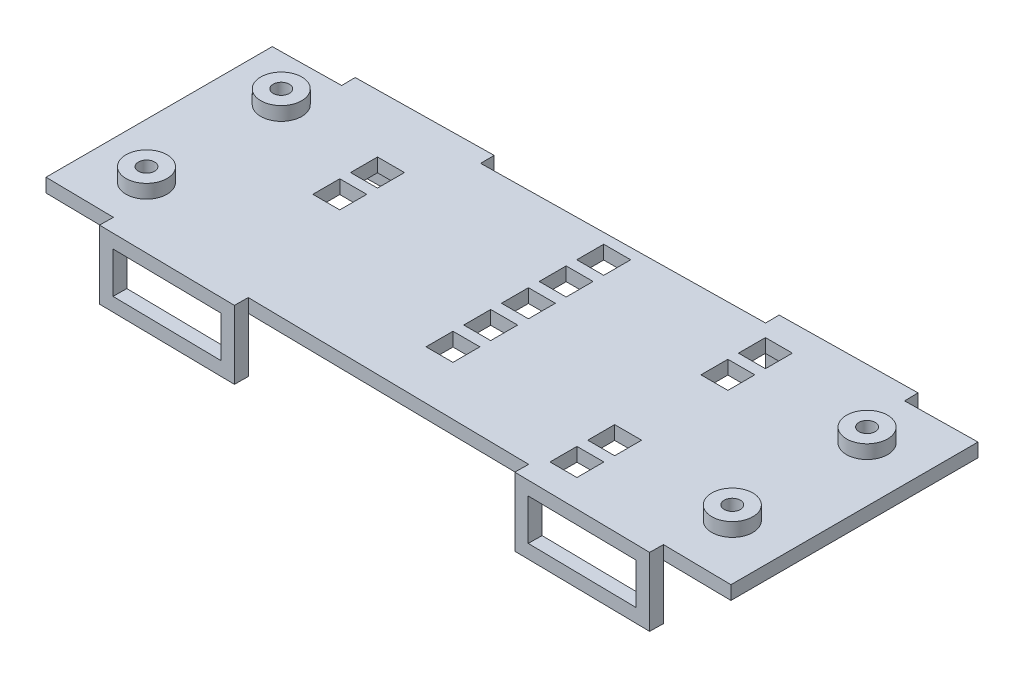
from build123d import *

# Parameters (mm, degrees)
BOSS_EXTRUDE1_DEPTH = 2.54
SKETCH3_W           = 25.4
SKETCH3_H           = 12.7
SKETCH3_W_2         = 20.32
SKETCH3_H_2         = 7.62
BOSS_EXTRUDE3_DEPTH = 2.54
SKETCH4_R           = 1.905
BOSS_EXTRUDE4_DEPTH = 5.08
SKETCH5_R           = 3.81
SKETCH5_R_2         = 1.5
BOSS_EXTRUDE5_DEPTH = 2.54
SKETCH6_W           = 25.4
SKETCH6_H           = 12.7
SKETCH6_W_2         = 20.32
SKETCH6_H_2         = 7.62
BOSS_EXTRUDE8_DEPTH = 2.54
SKETCH12_W          = 5
SKETCH12_H          = 5
CUT_EXTRUDE1_DEPTH  = 2.54


with BuildPart() as part:
    # Sketch2 → Boss-Extrude1 (new body)
    with BuildSketch(Plane(origin=(0, 0, 0), x_dir=(1, 0, 0), z_dir=(0, 1, 0))):
        Polygon((-80.183865598, 25.601069918), (48.816134402, 27.536069918), (48.816134402, -18.304155069), (-80.183865598, -16.369155069), align=None)
    extrude(amount=BOSS_EXTRUDE1_DEPTH)

    # Sketch3 → Boss-Extrude3 (add)
    # profile 1 of 2: a face of its own
    with BuildSketch(Plane(origin=(0.046703878, 0, 17.572613611), x_dir=(0.9998875189808162, 0, 0.014998312784712321), z_dir=(-0.01499831278471232, 0, 0.9998875189808161))):
        with Locations((-54.839594907, -3.81)):
            Rectangle(SKETCH3_W, SKETCH3_H)
        with Locations((-54.839594907, -3.81)):
            Rectangle(SKETCH3_W_2, SKETCH3_H_2, mode=Mode.SUBTRACT)
    # profile 2 of 2: a face of its own
    with BuildSketch(Plane(origin=(0.046703878, 0, 17.572613611), x_dir=(0.9998875189808162, 0, 0.014998312784712321), z_dir=(-0.01499831278471232, 0, 0.9998875189808161))):
        with Locations((23.374916777, -3.81)):
            Rectangle(SKETCH3_W, SKETCH3_H)
        with Locations((23.374916777, -3.81)):
            Rectangle(SKETCH3_W_2, SKETCH3_H_2, mode=Mode.SUBTRACT)
    extrude(amount=BOSS_EXTRUDE3_DEPTH)

    # Sketch4 → Boss-Extrude4 (add)
    with BuildSketch(Plane.XZ):
        with Locations(Location((-72.563865598, 8.982611367, 0), (0, 0, 270))):
            Circle(SKETCH4_R)
        with Locations(Location((-72.183865598, -18.220226216, 0), (0, 0, 270))):
            Circle(SKETCH4_R)
        with Locations(Location((41.196134402, -19.920926216, 0), (0, 0, 270))):
            Circle(SKETCH4_R)
        with Locations(Location((41.196134402, 10.689011367, 0), (0, 0, 270))):
            Circle(SKETCH4_R)
    extrude(amount=BOSS_EXTRUDE4_DEPTH)

    # Sketch5 → Boss-Extrude5 (add)
    # profile 1 of 4: a face of its own
    with BuildSketch(Plane(origin=(0, 2.54, 0), x_dir=(1, 0, 0), z_dir=(0, 1, 0))):
        with Locations(Location((-70.023865598, 17.115957425, 0), (0, 0, 90))):
            Circle(SKETCH5_R)
        with Locations(Location((-70.023865598, 17.115957425, 0), (0, 0, 270))):
            Circle(SKETCH5_R_2, mode=Mode.SUBTRACT)
    # profile 2 of 4: a face of its own
    with BuildSketch(Plane(origin=(0, 2.54, 0), x_dir=(1, 0, 0), z_dir=(0, 1, 0))):
        with Locations(Location((-70.023865598, -7.884042575, 0), (0, 0, 90))):
            Circle(SKETCH5_R)
        with Locations(Location((-70.023865598, -7.884042575, 0), (0, 0, 270))):
            Circle(SKETCH5_R_2, mode=Mode.SUBTRACT)
    # profile 3 of 4: a face of its own
    with BuildSketch(Plane(origin=(0, 2.54, 0), x_dir=(1, 0, 0), z_dir=(0, 1, 0))):
        with Locations(Location((38.656134402, -7.884042575, 0), (0, 0, 90))):
            Circle(SKETCH5_R)
        with Locations(Location((38.656134402, -7.884042575, 0), (0, 0, 270))):
            Circle(SKETCH5_R_2, mode=Mode.SUBTRACT)
    # profile 4 of 4: a face of its own
    with BuildSketch(Plane(origin=(0, 2.54, 0), x_dir=(1, 0, 0), z_dir=(0, 1, 0))):
        with Locations(Location((38.656134402, 17.115957425, 0), (0, 0, 90))):
            Circle(SKETCH5_R)
        with Locations(Location((38.656134402, 17.115957425, 0), (0, 0, 270))):
            Circle(SKETCH5_R_2, mode=Mode.SUBTRACT)
    extrude(amount=BOSS_EXTRUDE5_DEPTH)

    # Sketch6 → Boss-Extrude8 (add)
    # profile 1 of 2: a face of its own
    with BuildSketch(Plane(origin=(-0.401966976, 0, -26.797798398), x_dir=(-0.9998875189808162, 0, 0.014998312784712349), z_dir=(-0.014998312784712347, 0, -0.9998875189808161))):
        with Locations((-23.097259161, -3.81)):
            Rectangle(SKETCH6_W, SKETCH6_H)
        with Locations((-23.097259161, -3.81)):
            Rectangle(SKETCH6_W_2, SKETCH6_H_2, mode=Mode.SUBTRACT)
    # profile 2 of 2: a face of its own
    with BuildSketch(Plane(origin=(-0.401966976, 0, -26.797798398), x_dir=(-0.9998875189808162, 0, 0.014998312784712349), z_dir=(-0.014998312784712347, 0, -0.9998875189808161))):
        with Locations((54.390873581, -3.81)):
            Rectangle(SKETCH6_W, SKETCH6_H)
        with Locations((54.390873581, -3.81)):
            Rectangle(SKETCH6_W_2, SKETCH6_H_2, mode=Mode.SUBTRACT)
    extrude(amount=BOSS_EXTRUDE8_DEPTH)

    # Sketch12 → Cut-Extrude1 (cut)
    with BuildSketch(Plane(origin=(0, 2.54, 0), x_dir=(1, 0, 0), z_dir=(0, 1, 0))):
        with Locations((-50.183865598, 15.131238659)):
            Rectangle(SKETCH12_W, SKETCH12_H)
        with Locations((-50.183865598, 8.131238659)):
            Rectangle(SKETCH12_W, SKETCH12_H)
        with Locations((-15.183865598, 22.10067619)):
            Rectangle(SKETCH12_W, SKETCH12_H)
        with Locations((-15.183865598, 15.131238659)):
            Rectangle(SKETCH12_W, SKETCH12_H)
        with Locations((-15.183865598, 8.131238659)):
            Rectangle(SKETCH12_W, SKETCH12_H)
        with Locations((-15.183865598, 1.131238659)):
            Rectangle(SKETCH12_W, SKETCH12_H)
        with Locations((-15.183865598, -5.868761341)):
            Rectangle(SKETCH12_W, SKETCH12_H)
        with Locations((14.816134346, -12.868761341)):
            Rectangle(SKETCH12_W, SKETCH12_H)
        with Locations((14.816134346, -5.868761341)):
            Rectangle(SKETCH12_W, SKETCH12_H)
        with Locations((14.816134346, 22.10067619)):
            Rectangle(SKETCH12_W, SKETCH12_H)
        with Locations((14.816134346, 15.131238659)):
            Rectangle(SKETCH12_W, SKETCH12_H)
    extrude(amount=-CUT_EXTRUDE1_DEPTH, mode=Mode.SUBTRACT)


solid = part.part
